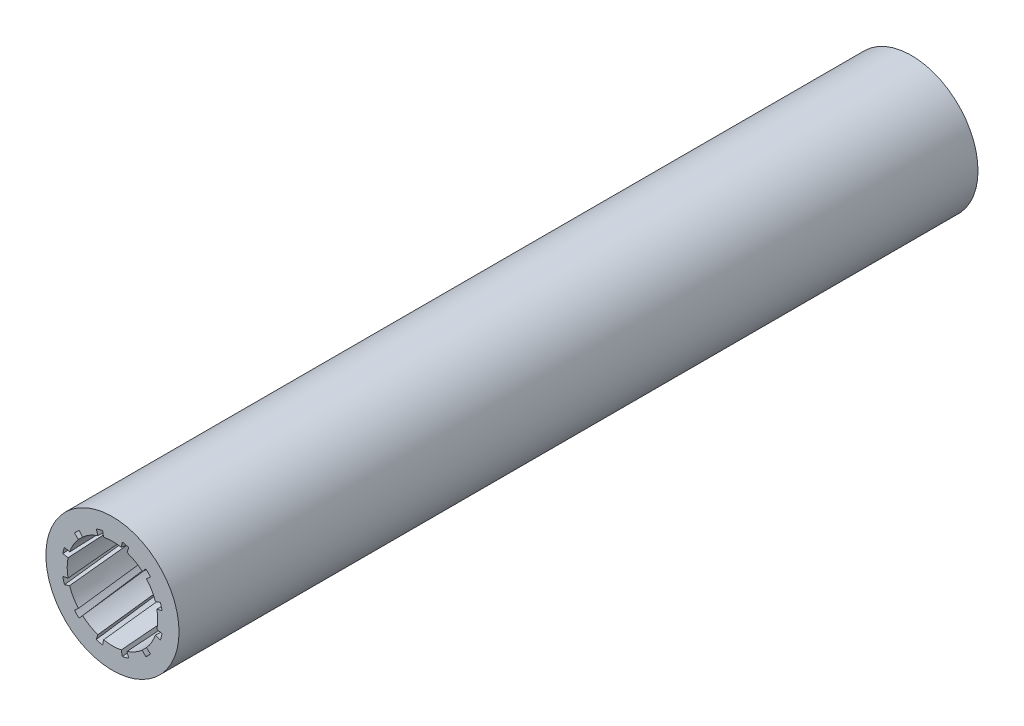
from build123d import *

# Parameters (mm, degrees)
SKETCH_1_R               = 12.5
SKETCH_1_R_2             = 9.5
EXTRUDE_1_DEPTH          = 150
SWEEP_1_PITCH            = 600
SWEEP_1_HEIGHT           = 150
SWEEP_1_RADIUS           = 9.5
SWEEP_1_START_ANGLE      = 90
PATTERN_CIRCULAR_1_COUNT = 12


with BuildPart() as part:
    # 草图1 → 凸台-拉伸1 (new body)
    with BuildSketch(Plane.XY):
        Circle(SKETCH_1_R)
        Circle(SKETCH_1_R_2, mode=Mode.SUBTRACT)
    extrude(amount=-EXTRUDE_1_DEPTH)

    # 扫描1: sweep along a helix
    with BuildLine() as sweep_1_path:
        add(Helix(SWEEP_1_PITCH, SWEEP_1_HEIGHT, SWEEP_1_RADIUS, center=(0, 0, 0), direction=(0, 0, -1), mode=Mode.PRIVATE).rotate(Axis((0, 0, 0), (0, 0, -1)), SWEEP_1_START_ANGLE))
    # 草图2 → 扫描1 (sweep)
    with BuildSketch(Plane.XY):
        with BuildLine():
            Line((-1.853358059, 9.317460164), (-1.658267737, 8.336674883))
            ThreePointArc((-1.658267737, 8.336674883), (0, 8.5), (1.658267737, 8.336674883))
            Line((1.658267737, 8.336674883), (1.853358059, 9.317460164))
            ThreePointArc((1.853358059, 9.317460164), (0, 9.5), (-1.853358059, 9.317460164))
        make_face()
    sweep_1 = sweep(path=sweep_1_path.line, is_frenet=True)

    # 阵列(圆周)1: 扫描1 ×12 about axis
    pattern_circular_1_axis = Axis((0, 0, -150), (0, 0, 1))
    for i in range(1, PATTERN_CIRCULAR_1_COUNT):
        add(sweep_1.rotate(pattern_circular_1_axis, i * 360 / PATTERN_CIRCULAR_1_COUNT))


solid = part.part
